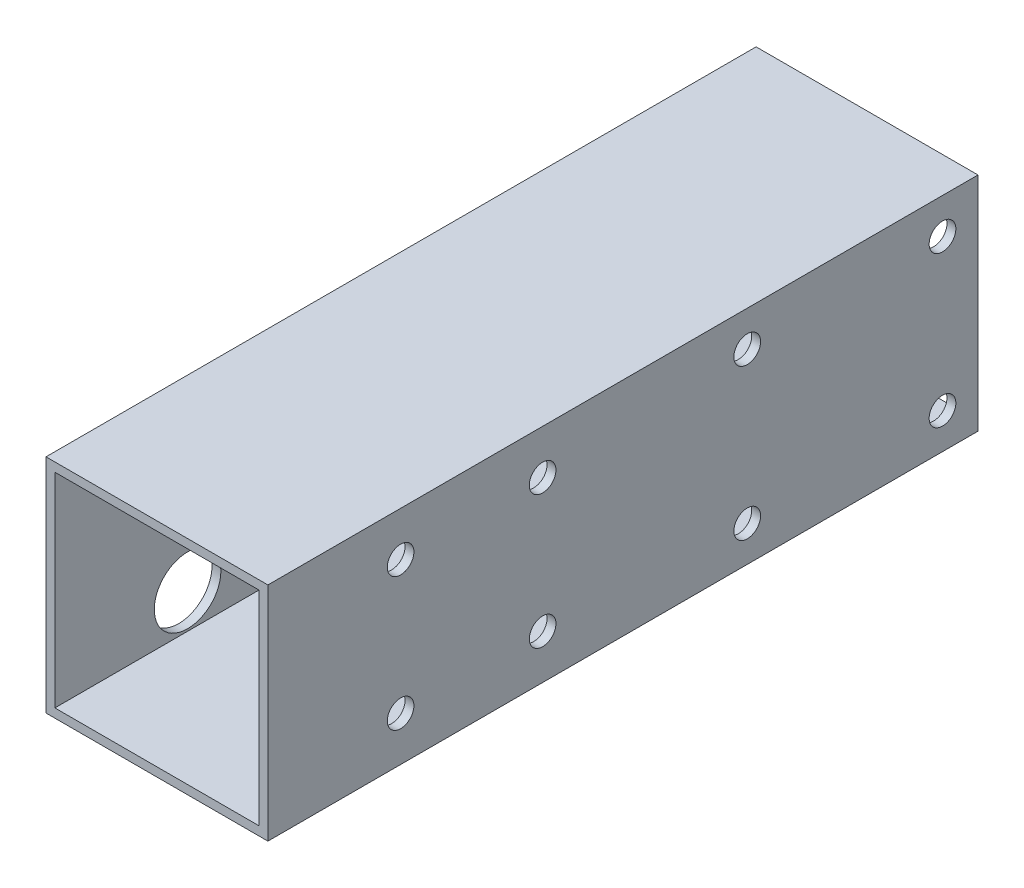
from build123d import *

# Parameters (mm, degrees)
SKETCH_1_W           = 25
SKETCH_1_H           = 25
SKETCH_1_W_2         = 23
SKETCH_1_H_2         = 23
EXTRUDE_1_DEPTH      = 40
SKETCH_4_R           = 1.5
CUT_EXTRUDE_3_DEPTH  = 10
SKETCH_17_R          = 3.75
CUT_EXTRUDE_16_DEPTH = 1
CUT_EXTRUDE_17_REACH = 50.798
SKETCH_18_R          = 1.505


with BuildPart() as part:
    # 草图1 → 凸台-拉伸1 (new, symmetric)
    with BuildSketch(Plane.XY):
        Rectangle(SKETCH_1_W, SKETCH_1_H)
        Rectangle(SKETCH_1_W_2, SKETCH_1_H_2, mode=Mode.SUBTRACT)
    extrude(amount=EXTRUDE_1_DEPTH, both=True)

    # 草图4 → 切除-拉伸3 (cut)
    with BuildSketch(Plane.ZY.offset(-11.5)):
        with Locations(Location((25.05, -7.5, 0), (0, 0, 270))):
            Circle(SKETCH_4_R)
        with Locations(Location((25.05, 7.5, 0), (0, 0, 270))):
            Circle(SKETCH_4_R)
        with Locations(Location((9.05, 7.5, 0), (0, 0, 270))):
            Circle(SKETCH_4_R)
        with Locations(Location((9.05, -7.5, 0), (0, 0, 270))):
            Circle(SKETCH_4_R)
    extrude(amount=-CUT_EXTRUDE_3_DEPTH, mode=Mode.SUBTRACT)

    # 草图17 → 切除-拉伸16 (cut)
    with BuildSketch(Plane.ZY.offset(12.5)):
        with Locations(Location((25.05, 7.5, 0), (0, 0, 270))):
            Circle(SKETCH_17_R)
        with Locations(Location((9.05, 7.5, 0), (0, 0, 270))):
            Circle(SKETCH_17_R)
        with Locations(Location((25.05, -7.5, 0), (0, 0, 270))):
            Circle(SKETCH_17_R)
        with Locations(Location((9.05, -7.5, 0), (0, 0, 270))):
            Circle(SKETCH_17_R)
    extrude(amount=-CUT_EXTRUDE_16_DEPTH, mode=Mode.SUBTRACT)

    # 切除-拉伸17: up to this face of the body (flat: up to its plane)
    cut_extrude_17_end = Plane(part.part.faces().sort_by_distance((12.5, 0, -0.244495165))[0])
    # 草图18 → 切除-拉伸17 (cut, up to the picked face)
    with BuildSketch(Plane.ZY.offset(12.5), mode=Mode.PRIVATE) as cut_extrude_17_sk1:
        with Locations(Location((-36, 8.5, 0), (0, 0, 270))):
            Circle(SKETCH_18_R)
    cut_extrude_17_tool1 = split(extrude(cut_extrude_17_sk1.sketch, amount=-CUT_EXTRUDE_17_REACH, mode=Mode.PRIVATE), bisect_by=cut_extrude_17_end, keep=Keep.BOTH, mode=Mode.PRIVATE)
    # 草图18 → 切除-拉伸17 (cut, up to the picked face)
    with BuildSketch(Plane.ZY.offset(12.5), mode=Mode.PRIVATE) as cut_extrude_17_sk2:
        with Locations(Location((-14, 8.5, 0), (0, 0, 270))):
            Circle(SKETCH_18_R)
    cut_extrude_17_tool2 = split(extrude(cut_extrude_17_sk2.sketch, amount=-CUT_EXTRUDE_17_REACH, mode=Mode.PRIVATE), bisect_by=cut_extrude_17_end, keep=Keep.BOTH, mode=Mode.PRIVATE)
    # 草图18 → 切除-拉伸17 (cut, up to the picked face)
    with BuildSketch(Plane.ZY.offset(12.5), mode=Mode.PRIVATE) as cut_extrude_17_sk3:
        with Locations(Location((-14, -8.5, 0), (0, 0, 270))):
            Circle(SKETCH_18_R)
    cut_extrude_17_tool3 = split(extrude(cut_extrude_17_sk3.sketch, amount=-CUT_EXTRUDE_17_REACH, mode=Mode.PRIVATE), bisect_by=cut_extrude_17_end, keep=Keep.BOTH, mode=Mode.PRIVATE)
    # 草图18 → 切除-拉伸17 (cut, up to the picked face)
    with BuildSketch(Plane.ZY.offset(12.5), mode=Mode.PRIVATE) as cut_extrude_17_sk4:
        with Locations(Location((-36, -8.5, 0), (0, 0, 270))):
            Circle(SKETCH_18_R)
    cut_extrude_17_tool4 = split(extrude(cut_extrude_17_sk4.sketch, amount=-CUT_EXTRUDE_17_REACH, mode=Mode.PRIVATE), bisect_by=cut_extrude_17_end, keep=Keep.BOTH, mode=Mode.PRIVATE)
    add(cut_extrude_17_tool1.solids().sort_by(Axis((-12.5, 8.5, -36), (1, 0, 0)))[0], mode=Mode.SUBTRACT)
    add(cut_extrude_17_tool2.solids().sort_by(Axis((-12.5, 8.5, -14), (1, 0, 0)))[0], mode=Mode.SUBTRACT)
    add(cut_extrude_17_tool3.solids().sort_by(Axis((-12.5, -8.5, -14), (1, 0, 0)))[0], mode=Mode.SUBTRACT)
    add(cut_extrude_17_tool4.solids().sort_by(Axis((-12.5, -8.5, -36), (1, 0, 0)))[0], mode=Mode.SUBTRACT)


solid = part.part
